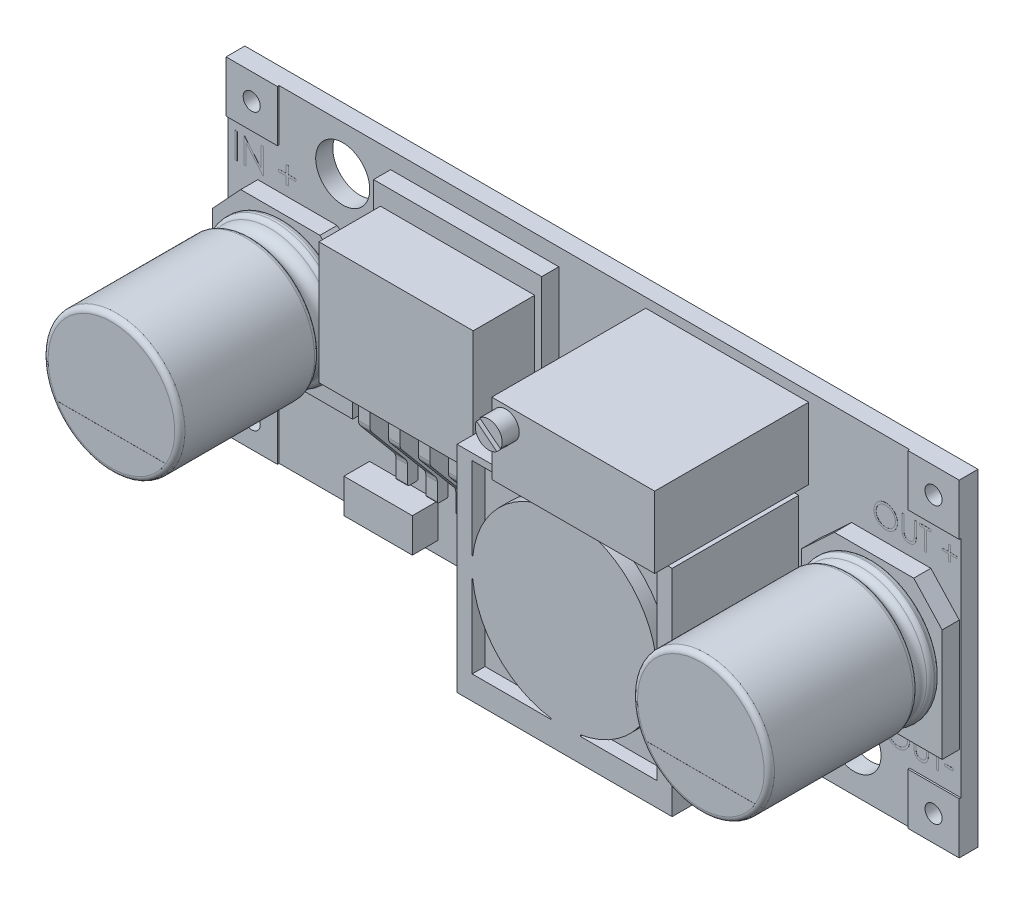
from build123d import *

# Parameters (mm, degrees)
SKETCH1_W            = 42.852737666
SKETCH1_H            = 19.127379028
SKETCH1_R            = 1.58
BOSS_EXTRUDE1_DEPTH  = 1
SKETCH2_W            = 3
SKETCH2_H            = 3
BOSS_EXTRUDE2_DEPTH  = 0.1
SKETCH3_R            = 0.5
CUT_EXTRUDE1_DEPTH   = 5
BOSS_EXTRUDE3_DEPTH  = 1
SKETCH6_W            = 9.83
SKETCH6_H            = 8.75
BOSS_EXTRUDE5_DEPTH  = 4.6
SKETCH7_W            = 9.83
SKETCH7_H            = 8.75
SKETCH7_W_2          = 9.014866003
SKETCH7_H_2          = 7.13033049
CUT_EXTRUDE2_DEPTH   = 3.6
SKETCH8_W            = 0.671327252
SKETCH8_H            = 3.75
BOSS_EXTRUDE6_DEPTH  = 8
SKETCH10_W           = 12.57
SKETCH10_H           = 12.57
BOSS_EXTRUDE7_DEPTH  = 7.4
CUT_EXTRUDE7_DEPTH   = 0.75
SKETCH13_W           = 9.52
SKETCH13_H           = 4.17
BOSS_EXTRUDE8_DEPTH  = 9
SKETCH14_R           = 0.785768403
BOSS_EXTRUDE9_DEPTH  = 1
CUT_EXTRUDE8_DEPTH   = 0.4
CUT_EXTRUDE10_DEPTH  = 9
SKETCH21_W           = 1
SKETCH21_H           = 0.471986251
BOSS_EXTRUDE11_DEPTH = 8.8665
BOSS_EXTRUDE15_DEPTH = 0.005
BOSS_EXTRUDE16_DEPTH = 0.005
SKETCH26_W           = 4
SKETCH26_H           = 2
BOSS_EXTRUDE18_DEPTH = 1.5
SKETCH28_W           = 0.134615385
SKETCH28_H           = 1.5
SKETCH28_W_2         = 0.576923077
SKETCH28_H_2         = 0.153846154
BOSS_EXTRUDE19_DEPTH = 0.005
SKETCH29_W           = 0.134615385
SKETCH29_H           = 1.5
BOSS_EXTRUDE20_DEPTH = 0.005
BOSS_EXTRUDE21_DEPTH = 0.005
SKETCH32_W           = 0.5
SKETCH32_H           = 0.133333333
BOSS_EXTRUDE23_DEPTH = 0.005


with BuildPart() as part:
    # Sketch1 → Boss-Extrude1 (new body)
    with BuildSketch(Plane.XY):
        Rectangle(SKETCH1_W, SKETCH1_H)
        with Locations((-14.706368833, 6.953689514)):
            Circle(SKETCH1_R, mode=Mode.SUBTRACT)
        with Locations((15.176368833, -6.773993326)):
            Circle(SKETCH1_R, mode=Mode.SUBTRACT)
    extrude(amount=BOSS_EXTRUDE1_DEPTH)

    # Sketch2 → Boss-Extrude2 (add)
    with BuildSketch(Plane.XY.offset(1)):
        with Locations((-19.926368833, 8.063689514)):
            Rectangle(SKETCH2_W, SKETCH2_H)
        with Locations((-19.926368833, -8.063689514)):
            Rectangle(SKETCH2_W, SKETCH2_H)
        with Locations((19.926368833, -8.063689514)):
            Rectangle(SKETCH2_W, SKETCH2_H)
        with Locations((19.926368833, 8.063689514)):
            Rectangle(SKETCH2_W, SKETCH2_H)
    extrude(amount=BOSS_EXTRUDE2_DEPTH)

    # Sketch3 → Cut-Extrude1 (cut)
    with BuildSketch(Plane.XY.offset(1.1)):
        with Locations((-19.926368833, 8.063689514)):
            Circle(SKETCH3_R)
        with Locations((-19.926368833, -8.063689514)):
            Circle(SKETCH3_R)
        with Locations((19.926368833, -8.063689514)):
            Circle(SKETCH3_R)
        with Locations((19.926368833, 8.063689514)):
            Circle(SKETCH3_R)
    extrude(amount=-CUT_EXTRUDE1_DEPTH, mode=Mode.SUBTRACT)

    # Sketch4 → Boss-Extrude3 (add)
    with BuildSketch(Plane.XY.offset(1)):
        Polygon((-15.037755442, 4.175), (-13.121368833, 2.397984661), (-13.121368833, -4.175), (-21.331368833, -4.175), (-21.331368833, 2.383236744), (-19.66991348, 4.175), align=None)
        Polygon((21.331368833, -4.175), (21.331368833, 2.383236744), (19.66991348, 4.175), (15.037755442, 4.175), (13.121368833, 2.397984661), (13.121368833, -4.175), align=None)
    extrude(amount=BOSS_EXTRUDE3_DEPTH)

    # Sketch6 → Boss-Extrude5 (add)
    with BuildSketch(Plane.XY.offset(1)):
        with Locations((-6.991368833, 4.188689514)):
            Rectangle(SKETCH6_W, SKETCH6_H)
    extrude(amount=BOSS_EXTRUDE5_DEPTH)

    # Sketch7 → Cut-Extrude2 (cut)
    with BuildSketch(Plane.XY.offset(5.6)):
        with Locations((-6.991368833, 4.188689514)):
            Rectangle(SKETCH7_W, SKETCH7_H)
        with Locations((-6.991368834, 3.853025888)):
            Rectangle(SKETCH7_W_2, SKETCH7_H_2, mode=Mode.SUBTRACT)
    extrude(amount=-CUT_EXTRUDE2_DEPTH, mode=Mode.SUBTRACT)

    # Sketch8 → Boss-Extrude6 (add)
    with BuildSketch(Plane(origin=(0, 0.287860643, 0), x_dir=(-1, 0, 0), z_dir=(0, -1, 0))):
        with Locations((8.85699558, -2.895840935)):
            Rectangle(SKETCH8_W, SKETCH8_H)
        with Locations((10.60699558, -2.895840935)):
            Rectangle(SKETCH8_W, SKETCH8_H)
        with Locations((7.10699558, -2.895840935)):
            Rectangle(SKETCH8_W, SKETCH8_H)
        with Locations((5.35699558, -2.895840935)):
            Rectangle(SKETCH8_W, SKETCH8_H)
        with Locations((3.60699558, -2.895840935)):
            Rectangle(SKETCH8_W, SKETCH8_H)
    extrude(amount=BOSS_EXTRUDE6_DEPTH)

    # Sketch10 → Boss-Extrude7 (add)
    with BuildSketch(Plane.XY.offset(1)):
        with Locations((5.661368833, -2.278689514)):
            Rectangle(SKETCH10_W, SKETCH10_H)
    extrude(amount=BOSS_EXTRUDE7_DEPTH)

    # Sketch11 → Cut-Extrude7 (cut)
    with BuildSketch(Plane.XY.offset(8.4)):
        with BuildLine():
            Line((0.261368833, -1.168201078), (0.29215187, -1.202921155))
            ThreePointArc((0.29215187, -1.202921155), (1.796004083, 1.992113497), (4.952819072, 3.574623221))
            Line((4.952819072, 3.574623221), (4.952819072, 3.621310486))
            Line((4.952819072, 3.621310486), (0.261368833, 3.621310486))
            Line((0.261368833, 3.621310486), (0.261368833, -1.168201078))
        make_face()
        with BuildLine():
            Line((0.261368833, -2.339421454), (0.29215187, -2.354457873))
            ThreePointArc((0.29215187, -2.354457873), (1.77039453, -5.523061153), (4.879917239, -7.121847139))
            Line((4.879917239, -7.121847139), (4.879917239, -7.178689514))
            Line((4.879917239, -7.178689514), (0.261368833, -7.178689514))
            Line((0.261368833, -7.178689514), (0.261368833, -2.339421454))
        make_face()
        with BuildLine():
            Line((11.061368833, -7.178689514), (11.061368833, -2.769135856))
            Line((11.061368833, -2.769135856), (10.969759931, -2.769135856))
            ThreePointArc((10.969759931, -2.769135856), (9.454565933, -5.622080694), (6.581950193, -7.099641493))
            Line((6.581950193, -7.099641493), (6.581950193, -7.178689514))
            Line((6.581950193, -7.178689514), (11.061368833, -7.178689514))
        make_face()
        with BuildLine():
            Line((6.280607425, 3.621310486), (6.280607425, 3.585687763))
            ThreePointArc((6.280607425, 3.585687763), (9.344711933, 2.170105696), (10.969759931, -0.788243173))
            Line((10.969759931, -0.788243173), (11.061368833, -0.788243173))
            Line((11.061368833, -0.788243173), (11.061368833, 3.621310486))
            Line((11.061368833, 3.621310486), (6.280607425, 3.621310486))
        make_face()
    extrude(amount=-CUT_EXTRUDE7_DEPTH, mode=Mode.SUBTRACT)

    # Sketch13 → Boss-Extrude8 (add)
    with BuildSketch(Plane.XY.offset(1)):
        with Locations((7.766965878, 6.922076652)):
            Rectangle(SKETCH13_W, SKETCH13_H)
    extrude(amount=BOSS_EXTRUDE8_DEPTH)

    # Sketch14 → Boss-Extrude9 (add)
    with BuildSketch(Plane.XY.offset(10)):
        with Locations((3.826540336, 8.02238566)):
            Circle(SKETCH14_R)
    extrude(amount=BOSS_EXTRUDE9_DEPTH)

    # Sketch16 → Cut-Extrude8 (cut)
    with BuildSketch(Plane.XY.offset(11)):
        Polygon((3.174779735, 8.708212326), (4.655828555, 7.530657116), (4.452314558, 7.274691057), (2.971265737, 8.452246267), align=None)
    extrude(amount=-CUT_EXTRUDE8_DEPTH, mode=Mode.SUBTRACT)

    # Sketch17 → Revolve1 (revolve)
    with BuildSketch(Plane(origin=(0, 0, 0), x_dir=(1, 0, 0), z_dir=(0, 1, 0))):
        with BuildLine():
            Line((-17.226368833, -2), (-17.226368833, -12))
            Line((-17.226368833, -12), (-20.926368833, -12))
            ThreePointArc((-20.926368833, -12), (-21.138500868, -11.912132034), (-21.226368833, -11.7))
            Line((-21.226368833, -11.7), (-21.226368833, -4.126856579))
            ThreePointArc((-21.226368833, -4.126856579), (-21.171634617, -3.954100406), (-21.027404197, -3.844382058))
            ThreePointArc((-21.027404197, -3.844382058), (-20.635591614, -3.288117016), (-21.027404197, -2.731851974))
            ThreePointArc((-21.027404197, -2.731851974), (-21.171634617, -2.622133626), (-21.226368833, -2.449377452))
            Line((-21.226368833, -2.449377452), (-21.226368833, -2.3))
            ThreePointArc((-21.226368833, -2.3), (-21.138500868, -2.087867966), (-20.926368833, -2))
            Line((-20.926368833, -2), (-17.226368833, -2))
        make_face()
    revolve(axis=Axis((-17.226368833, 0, 2), (0, 0, 1)))

    # Sketch18 → Revolve2 (revolve)
    with BuildSketch(Plane(origin=(0, 0, 0), x_dir=(1, 0, 0), z_dir=(0, 1, 0)), mode=Mode.PRIVATE) as revolve2_sk:
        with BuildLine():
            Line((17.226368833, -2), (17.226368833, -12))
            Line((17.226368833, -12), (20.926368833, -12))
            ThreePointArc((20.926368833, -12), (21.138500868, -11.912132034), (21.226368833, -11.7))
            Line((21.226368833, -11.7), (21.226368833, -3.602613577))
            ThreePointArc((21.226368833, -3.602613577), (21.180569431, -3.443296107), (21.057155126, -3.332622937))
            ThreePointArc((21.057155126, -3.332622937), (20.838223322, -2.983304086), (21.057155126, -2.633985236))
            ThreePointArc((21.057155126, -2.633985236), (21.180569431, -2.523312065), (21.226368833, -2.363994596))
            Line((21.226368833, -2.363994596), (21.226368833, -2.3))
            ThreePointArc((21.226368833, -2.3), (21.138500868, -2.087867966), (20.926368833, -2))
            Line((20.926368833, -2), (17.226368833, -2))
        make_face()
    revolve(revolve2_sk.sketch.rotate(Axis((17.226368833, 0, 2), (0, 0, 1)), 180), axis=Axis((17.226368833, 0, 2), (0, 0, 1)))

    # Sketch20 → Cut-Extrude10 (cut)
    with BuildSketch(Plane.ZY.offset(10.942659206)):
        with BuildLine():
            Line((3.844382058, 0.289594832), (3.844382058, -2.233611219))
            ThreePointArc((3.844382058, -2.233611219), (3.814255779, -2.404545961), (3.727507314, -2.554882192))
            Line((3.727507314, -2.554882192), (1.771316926, -4.887697811))
            ThreePointArc((1.771316926, -4.887697811), (1.684568461, -5.038034042), (1.654442182, -5.208968784))
            Line((1.654442182, -5.208968784), (1.654442182, -6.229630862))
            ThreePointArc((1.654442182, -6.229630862), (1.62515286, -6.30034154), (1.554442182, -6.329630862))
            Line((1.554442182, -6.329630862), (1.11972155, -6.329630862))
            ThreePointArc((1.11972155, -6.329630862), (1.049409976, -6.300738404), (1.019727886, -6.230756512))
            Line((1.019727886, -6.230756512), (1.020840935, -4.455804963))
            Line((1.020840935, -4.455804963), (1.118926503, -4.336466333))
            Line((1.118926503, -4.336466333), (2.914592321, -2.19508107))
            ThreePointArc((2.914592321, -2.19508107), (3.001340787, -2.044744838), (3.031467065, -1.873810097))
            Line((3.031467065, -1.873810097), (3.031467065, 0.289594832))
            Line((3.031467065, 0.289594832), (1, 0.289594832))
            Line((1, 0.289594832), (1.020840935, -10.491278281))
            Line((1.020840935, -10.491278281), (8.137669671, -10.491278281))
            Line((8.137669671, -10.491278281), (8.137669671, 0.289594832))
            Line((8.137669671, 0.289594832), (3.844382058, 0.289594832))
        make_face()
    extrude(amount=-CUT_EXTRUDE10_DEPTH, mode=Mode.SUBTRACT)

    # Sketch21 → Boss-Extrude11 (add)
    with BuildSketch(Plane(origin=(-10.942659206, 0, 0), x_dir=(0, 0, -1), z_dir=(1, 0, 0))):
        with Locations((-1.5, 0.051867518)):
            Rectangle(SKETCH21_W, SKETCH21_H)
    extrude(amount=BOSS_EXTRUDE11_DEPTH)

    # Sketch24 → Boss-Extrude15 (add)
    # profile 1 of 6: a face of its own
    with BuildSketch(Plane(origin=(0, 0, 0), x_dir=(-1, 0, 0), z_dir=(0, 0, -1))):
        with BuildLine():
            Line((-8.853067867, -3.201602436), (-8.300583893, -3.201602436))
            add(Edge.make_bspline(
                [(-8.300583893, -3.201602436), (-8.237941582, -3.202119806), (-8.116803517, -3.2031203), (-7.941132069, -3.211369625), (-7.778093699, -3.225929961), (-7.627390082, -3.246082478), (-7.489008967, -3.271793508), (-7.362897501, -3.302926325), (-7.248929994, -3.33975745), (-7.146788875, -3.384011044), (-7.052741114, -3.433669947), (-6.964605447, -3.490333151), (-6.880863878, -3.553292994), (-6.800951691, -3.622151102), (-6.726488735, -3.698419974), (-6.656427117, -3.781295695), (-6.590498662, -3.870598609), (-6.528925787, -3.965401624), (-6.473540425, -4.065638061), (-6.425157038, -4.17040503), (-6.383616919, -4.278708953), (-6.350761029, -4.391144359), (-6.324787465, -4.507073724), (-6.30590624, -4.626948975), (-6.294380489, -4.750619862), (-6.293179073, -4.834256468), (-6.292571072, -4.876582403)],
                knots=[0, 0, 0, 0, 1.508928034, 2.917973822, 4.235011166, 5.450779055, 6.579221784, 7.623755204, 8.577985451, 9.460610614, 10.301756591, 11.137250569, 11.981705789, 12.823774396, 13.675702816, 14.546470419, 15.435981066, 16.347923198, 17.267651715, 18.192054867, 19.125737078, 20.059147693, 21.011116727, 21.985721956, 22.980635317, 24, 24, 24, 24], degree=3))
            add(Edge.make_bspline(
                [(-6.292571072, -4.876582403), (-6.293425352, -4.920311883), (-6.295123351, -5.007230329), (-6.307307235, -5.136032527), (-6.327011019, -5.262226316), (-6.354170607, -5.385767842), (-6.3899407, -5.506706382), (-6.434603556, -5.624404735), (-6.485458331, -5.740040139), (-6.545219263, -5.851234457), (-6.609667677, -5.957998129), (-6.679444673, -6.057826354), (-6.752629295, -6.150611392), (-6.831061771, -6.235080332), (-6.913235525, -6.312436895), (-6.99918107, -6.382679297), (-7.089825573, -6.444833173), (-7.185067073, -6.50000274), (-7.287441231, -6.548363362), (-7.398515284, -6.589331765), (-7.518630599, -6.624543208), (-7.64836209, -6.652031833), (-7.787090893, -6.674472281), (-7.935212637, -6.690545123), (-8.092710466, -6.699344016), (-8.200780305, -6.700834932), (-8.25641322, -6.701602436)],
                knots=[0, 0, 0, 0, 1.035326767, 2.057856534, 3.060426681, 4.057975219, 5.050723532, 6.043595218, 7.036960241, 8.039530388, 9.030318104, 9.988216712, 10.921569661, 11.826132526, 12.714780289, 13.59198308, 14.451536877, 15.31430869, 16.195534129, 17.128821459, 18.114698389, 19.15667332, 20.266554844, 21.441073174, 22.682698532, 24, 24, 24, 24], degree=3))
            Line((-8.25641322, -6.701602436), (-9.343853124, -6.701602436))
            Line((-9.343853124, -6.701602436), (-8.853067867, -3.201602436))
        make_face()
        with BuildLine():
            Line((-8.301285015, -3.784935769), (-8.628007771, -6.118269102))
            Line((-8.628007771, -6.118269102), (-8.401545431, -6.118269102))
            add(Edge.make_bspline(
                [(-8.401545431, -6.118269102), (-8.359472268, -6.118053614), (-8.278575358, -6.11763928), (-8.161717216, -6.113000816), (-8.053842471, -6.107478867), (-7.955006915, -6.097225324), (-7.864849413, -6.085815911), (-7.783982406, -6.070951496), (-7.711475788, -6.05497426), (-7.667362252, -6.039888218), (-7.646437258, -6.032732243)],
                knots=[0, 0, 0, 0, 1.323091274, 2.54399687, 3.677836413, 4.719289959, 5.668358043, 6.534823038, 7.305002022, 8, 8, 8, 8], degree=3))
            add(Edge.make_bspline(
                [(-7.646437258, -6.032732243), (-7.619551047, -6.022282483), (-7.566139112, -6.001523071), (-7.490813536, -5.961141901), (-7.417728748, -5.91834265), (-7.350080591, -5.868000695), (-7.285471108, -5.813353309), (-7.226484995, -5.752065729), (-7.170258599, -5.686392133), (-7.118784674, -5.615067595), (-7.071727449, -5.539236121), (-7.03165369, -5.4583046), (-6.997050982, -5.373348417), (-6.969343034, -5.283665493), (-6.947389037, -5.18996392), (-6.932390442, -5.091965491), (-6.921919041, -4.989689841), (-6.921161696, -4.919845967), (-6.920776201, -4.884294743)],
                knots=[0, 0, 0, 0, 0.952655881, 1.892538673, 2.821337892, 3.750040712, 4.676008024, 5.615700279, 6.558436491, 7.532008524, 8.520486916, 9.505184105, 10.513747313, 11.549809891, 12.604882282, 13.692134403, 14.825273528, 16, 16, 16, 16], degree=3))
            add(Edge.make_bspline(
                [(-6.920776201, -4.884294743), (-6.921179041, -4.855071947), (-6.921966371, -4.79795763), (-6.928152939, -4.714096916), (-6.939619582, -4.633858217), (-6.954627208, -4.557196683), (-6.974573544, -4.484179286), (-6.998342056, -4.414821288), (-7.026031761, -4.348620501), (-7.070347076, -4.266962682), (-7.13351499, -4.171693487), (-7.225790052, -4.070996953), (-7.33302123, -3.98497526), (-7.432971683, -3.92486041), (-7.520199452, -3.883726716), (-7.59183677, -3.8573879), (-7.668642489, -3.83477797), (-7.750749545, -3.817072039), (-7.837674138, -3.801859673), (-7.930010535, -3.792738629), (-8.027513589, -3.785982745), (-8.094440862, -3.785290994), (-8.128809053, -3.784935769)],
                knots=[0, 0, 0, 0, 0.941373656, 1.839862062, 2.706559874, 3.551131217, 4.354742518, 5.142827075, 5.911946928, 6.663057697, 8.133107042, 9.582556681, 11.0440985, 12.547036792, 13.328439944, 14.147940985, 15.003216405, 15.905576335, 16.852443473, 17.844335315, 18.893032825, 20, 20, 20, 20], degree=3))
            Line((-8.128809053, -3.784935769), (-8.301285015, -3.784935769))
        make_face(mode=Mode.SUBTRACT)
    # profile 2 of 6: a face of its own
    with BuildSketch(Plane(origin=(0, 0, 0), x_dir=(-1, 0, 0), z_dir=(0, 0, -1))):
        with BuildLine():
            Line((-2.516329085, -3.641906923), (-3.000804245, -4.075901314))
            add(Edge.make_bspline(
                [(-3.000804245, -4.075901314), (-3.027689891, -4.046443608), (-3.081355477, -3.987644013), (-3.174342582, -3.912136081), (-3.27509105, -3.846413961), (-3.384058099, -3.79185051), (-3.499594178, -3.74827086), (-3.620707569, -3.71756322), (-3.746679282, -3.698815861), (-3.832269402, -3.696413914), (-3.875804245, -3.695192179)],
                knots=[0, 0, 0, 0, 0.971056601, 1.938295404, 2.910103745, 3.898650509, 4.902833105, 5.914277838, 6.939111328, 8, 8, 8, 8], degree=3))
            add(Edge.make_bspline(
                [(-3.875804245, -3.695192179), (-3.906675858, -3.695675914), (-3.968088952, -3.696638212), (-4.059697798, -3.706102921), (-4.150266957, -3.72165531), (-4.239943908, -3.742704476), (-4.328944794, -3.76918723), (-4.416297099, -3.803150435), (-4.502814844, -3.842651021), (-4.588093545, -3.887070685), (-4.670046059, -3.937343286), (-4.748053762, -3.991342039), (-4.821369329, -4.048887662), (-4.889619278, -4.110909594), (-4.953232815, -4.176978556), (-5.013363848, -4.246067771), (-5.067011582, -4.32032101), (-5.116983668, -4.396986923), (-5.160899411, -4.47683975), (-5.199278835, -4.558168777), (-5.233164672, -4.640393752), (-5.258161359, -4.724798488), (-5.280114045, -4.809950053), (-5.294189305, -4.89679304), (-5.304020845, -4.984796415), (-5.304933001, -5.043888985), (-5.305391585, -5.073597628)],
                knots=[0, 0, 0, 0, 1.01063672, 2.010466049, 3.011934156, 4.018040672, 5.025194429, 6.049901815, 7.084166442, 8.138480354, 9.196343408, 10.230183256, 11.243713301, 12.245999792, 13.247233952, 14.245803109, 15.242258641, 16.244194478, 17.240973215, 18.223430354, 19.188354289, 20.149355445, 21.103383867, 22.065846529, 23.027609163, 24, 24, 24, 24], degree=3))
            add(Edge.make_bspline(
                [(-5.305391585, -5.073597628), (-5.304618516, -5.113391242), (-5.303097502, -5.191685253), (-5.286027884, -5.306388491), (-5.2606216, -5.416222202), (-5.223849505, -5.520820556), (-5.176425789, -5.619953738), (-5.119765611, -5.714793755), (-5.050821374, -5.803061224), (-4.973598797, -5.886385022), (-4.887657649, -5.961519344), (-4.795556562, -6.028219859), (-4.696709043, -6.083473122), (-4.592429621, -6.1296467), (-4.481782992, -6.164421161), (-4.365622271, -6.189522151), (-4.243638542, -6.205554834), (-4.160277037, -6.207181632), (-4.117691265, -6.208012692)],
                knots=[0, 0, 0, 0, 1.037508871, 2.041300697, 3.018951676, 3.975513831, 4.927438979, 5.88223082, 6.851861871, 7.844178858, 8.842305637, 9.825493826, 10.805727671, 11.791408773, 12.796144752, 13.825955475, 14.88937509, 16, 16, 16, 16], degree=3))
            add(Edge.make_bspline(
                [(-4.117691265, -6.208012692), (-4.071855206, -6.207230549), (-3.981640883, -6.205691138), (-3.848815917, -6.192765403), (-3.720676217, -6.1717802), (-3.597313824, -6.14259959), (-3.478605564, -6.104256454), (-3.364521871, -6.058307341), (-3.254927312, -6.003502583), (-3.186042547, -5.96037832), (-3.151545431, -5.938781923)],
                knots=[0, 0, 0, 0, 1.080949117, 2.127519159, 3.144326023, 4.141762213, 5.114520833, 6.083915527, 7.040435296, 8, 8, 8, 8], degree=3))
            Line((-3.151545431, -5.938781923), (-2.758216104, -6.372075192))
            add(Edge.make_bspline(
                [(-2.758216104, -6.372075192), (-2.808420285, -6.405619613), (-2.908553491, -6.472524609), (-3.067420241, -6.557854709), (-3.232244225, -6.629482919), (-3.402422898, -6.688487904), (-3.578358143, -6.735128768), (-3.760308538, -6.767720941), (-3.948257224, -6.788017038), (-4.075571862, -6.790225976), (-4.140127162, -6.791346025)],
                knots=[0, 0, 0, 0, 0.987115275, 1.968820479, 2.944554184, 3.923725951, 4.912076401, 5.918257257, 6.944445583, 8, 8, 8, 8], degree=3))
            add(Edge.make_bspline(
                [(-4.140127162, -6.791346025), (-4.185251648, -6.79064853), (-4.273972366, -6.789277163), (-4.404318153, -6.779211808), (-4.529637736, -6.763462206), (-4.649689886, -6.740131924), (-4.764708942, -6.710859161), (-4.874722042, -6.675176034), (-4.979294215, -6.632155799), (-5.079055533, -6.583302387), (-5.173473742, -6.527349338), (-5.263416272, -6.465790051), (-5.348210229, -6.397518319), (-5.428568985, -6.323744653), (-5.503749999, -6.243559869), (-5.573944978, -6.156875672), (-5.639773669, -6.064401239), (-5.70059437, -5.966617988), (-5.755204621, -5.864510256), (-5.802525631, -5.759422355), (-5.843974618, -5.652784518), (-5.875684831, -5.543225299), (-5.90207982, -5.432193883), (-5.919990953, -5.318507609), (-5.931786958, -5.20308897), (-5.932991892, -5.125276243), (-5.933596713, -5.08621782)],
                knots=[0, 0, 0, 0, 1.169367826, 2.299132101, 3.38621766, 4.441052208, 5.466435492, 6.460518735, 7.435693363, 8.394593391, 9.33676259, 10.277587488, 11.216890426, 12.155626877, 13.10261201, 14.062754619, 15.044266364, 16.042621295, 17.045211417, 18.042739217, 19.028130471, 20.007415779, 20.996189116, 21.983978755, 22.988049715, 24, 24, 24, 24], degree=3))
            add(Edge.make_bspline(
                [(-5.933596713, -5.08621782), (-5.932861533, -5.04411236), (-5.931395617, -4.960155988), (-5.917258447, -4.834871806), (-5.895871713, -4.710906453), (-5.865255859, -4.588265385), (-5.827115892, -4.466902485), (-5.778657886, -4.347333602), (-5.722841666, -4.228544831), (-5.657519442, -4.112320265), (-5.58623039, -3.999158565), (-5.507106607, -3.892166544), (-5.422083349, -3.791259164), (-5.331916975, -3.695486851), (-5.234644888, -3.606974946), (-5.131164403, -3.524800413), (-5.021858395, -3.448393062), (-4.906896824, -3.37836971), (-4.787888864, -3.315426453), (-4.665133983, -3.261466361), (-4.540055011, -3.214775861), (-4.412146752, -3.177011734), (-4.281335611, -3.148296897), (-4.148154069, -3.127222676), (-4.012079129, -3.114262257), (-3.920470313, -3.112663054), (-3.874402002, -3.111858846)],
                knots=[0, 0, 0, 0, 0.95794203, 1.910092795, 2.865876462, 3.819215003, 4.78477586, 5.758651491, 6.753180615, 7.769892659, 8.790977917, 9.795230985, 10.79565955, 11.792688852, 12.786634645, 13.785945562, 14.798181656, 15.819862441, 16.847685968, 17.859754353, 18.869513914, 19.884373831, 20.892254455, 21.915374149, 22.951681752, 24, 24, 24, 24], degree=3))
            add(Edge.make_bspline(
                [(-3.874402002, -3.111858846), (-3.810055091, -3.11349608), (-3.682990372, -3.116729098), (-3.495855983, -3.141778928), (-3.315253236, -3.183068658), (-3.141427217, -3.241768031), (-2.973739072, -3.316085821), (-2.813300361, -3.407960246), (-2.659434296, -3.516158186), (-2.564439018, -3.599631989), (-2.516329085, -3.641906923)],
                knots=[0, 0, 0, 0, 1.033545388, 2.040923972, 3.027343848, 4.005734438, 4.983995331, 5.969464303, 6.971644303, 8, 8, 8, 8], degree=3))
        make_face()
    # profile 3 of 6: a face of its own
    with BuildSketch(Plane(origin=(0, 0, 0), x_dir=(-1, 0, 0), z_dir=(0, 0, -1))):
        Polygon((-0.410159213, -3.111858846), (0.222953767, -3.111858846), (0.079924921, -4.143910128), (0.480265466, -4.143910128), (0.404544312, -4.682371666), (0.004904889, -4.682371666), (-0.274842707, -6.701602436), (-0.907955688, -6.701602436), (-0.628208092, -4.682371666), (-0.938103925, -4.682371666), (-0.865187258, -4.143910128), (-0.55318806, -4.143910128), align=None)
    # profile 4 of 6: a face of its own
    with BuildSketch(Plane(origin=(0, 0, 0), x_dir=(-1, 0, 0), z_dir=(0, 0, -1))):
        with BuildLine():
            add(Edge.make_bspline(
                [(2.047973799, -4.099038333), (2.076274595, -4.099299194), (2.132285658, -4.099815473), (2.215320607, -4.108289871), (2.296630321, -4.119781478), (2.375824228, -4.136585397), (2.452832337, -4.158540762), (2.527980657, -4.185285631), (2.60145491, -4.216550706), (2.672238505, -4.253235701), (2.740269169, -4.293778731), (2.804923453, -4.338492614), (2.865124606, -4.38802221), (2.922560732, -4.440435569), (2.974812186, -4.498109595), (3.023299378, -4.559402443), (3.068608414, -4.624279456), (3.109671999, -4.693140326), (3.145833773, -4.765563415), (3.178489854, -4.839690233), (3.205172311, -4.916663144), (3.226421779, -4.995747754), (3.2447274, -5.076764828), (3.255780853, -5.160081933), (3.264388007, -5.245427615), (3.264874499, -5.303074566), (3.265121235, -5.33231157)],
                knots=[0, 0, 0, 0, 1.048380346, 2.074885017, 3.090367486, 4.090964834, 5.072523792, 6.056029873, 7.045505985, 8.029469653, 9.008388104, 9.979110116, 10.939576094, 11.895736256, 12.858269977, 13.820062943, 14.790784955, 15.789017664, 16.788414625, 17.789274365, 18.789121639, 19.804049856, 20.823403653, 21.864603227, 22.916983403, 24, 24, 24, 24], degree=3))
            add(Edge.make_bspline(
                [(3.265121235, -5.33231157), (3.263688521, -5.380517747), (3.260866665, -5.475463977), (3.241081251, -5.615137253), (3.207266567, -5.74903449), (3.159927545, -5.877543045), (3.099373535, -6.000696485), (3.02535317, -6.118605175), (2.937002499, -6.230040516), (2.837387566, -6.33526087), (2.728079792, -6.431651196), (2.610873296, -6.515964174), (2.4872728, -6.58723861), (2.357586463, -6.646044139), (2.220868971, -6.690744346), (2.07813408, -6.722759932), (1.929142107, -6.743245327), (1.827655912, -6.74538424), (1.775938543, -6.74647423)],
                knots=[0, 0, 0, 0, 1.011104245, 1.991457176, 2.952197104, 3.902991464, 4.858928698, 5.826026836, 6.817568841, 7.837123857, 8.861887107, 9.870051414, 10.860623363, 11.850212162, 12.851715058, 13.872153699, 14.915649431, 16, 16, 16, 16], degree=3))
            add(Edge.make_bspline(
                [(1.775938543, -6.74647423), (1.731249527, -6.745651728), (1.643928175, -6.744044575), (1.516603984, -6.728008378), (1.396019942, -6.703330608), (1.282509145, -6.667113928), (1.175619563, -6.621862978), (1.075787771, -6.565800352), (0.982759572, -6.499972186), (0.898424611, -6.423206126), (0.821653652, -6.339253127), (0.755109673, -6.247910845), (0.698196439, -6.150383479), (0.652979584, -6.046129966), (0.616951777, -5.936058116), (0.591083712, -5.819874659), (0.575325308, -5.697330635), (0.573662775, -5.613509398), (0.572813543, -5.57069298)],
                knots=[0, 0, 0, 0, 1.130534475, 2.209039425, 3.242686211, 4.241648197, 5.219495055, 6.175504508, 7.134035888, 8.097337106, 9.056251676, 10.008649417, 10.952170628, 11.908308165, 12.879116703, 13.879338768, 14.916752852, 16, 16, 16, 16], degree=3))
            add(Edge.make_bspline(
                [(0.572813543, -5.57069298), (0.574198313, -5.518982083), (0.576922459, -5.417255379), (0.597291897, -5.267943873), (0.632580393, -5.125671277), (0.6813243, -4.990183027), (0.742880461, -4.860841068), (0.820364868, -4.739285803), (0.910265871, -4.623536234), (1.013729882, -4.516782318), (1.125759831, -4.419397073), (1.243349941, -4.333250807), (1.366627978, -4.261598623), (1.493529484, -4.201082976), (1.626190512, -4.155869136), (1.762694186, -4.122668379), (1.903868267, -4.102397962), (1.999529842, -4.100167739), (2.047973799, -4.099038333)],
                knots=[0, 0, 0, 0, 1.070407058, 2.105725986, 3.11260329, 4.099768105, 5.082273654, 6.071629737, 7.078227986, 8.111679688, 9.144009435, 10.148605521, 11.124500349, 12.092034995, 13.054511379, 14.020338642, 14.997480131, 16, 16, 16, 16], degree=3))
        make_face()
        with BuildLine():
            add(Edge.make_bspline(
                [(2.001699761, -4.682371666), (1.970338874, -4.683134377), (1.909219823, -4.68462082), (1.820371221, -4.697480802), (1.737116329, -4.718430504), (1.65914239, -4.747759684), (1.587488188, -4.786890542), (1.520576481, -4.833288128), (1.460350398, -4.889250385), (1.406081405, -4.952161975), (1.358245618, -5.020002489), (1.316206249, -5.089796935), (1.280624192, -5.161264017), (1.252338528, -5.234222955), (1.228428254, -5.308196637), (1.212541328, -5.383864445), (1.203329833, -5.461089737), (1.201794454, -5.512942704), (1.201018671, -5.5391425)],
                knots=[0, 0, 0, 0, 1.147646984, 2.236642535, 3.278363253, 4.285788599, 5.277283386, 6.259990092, 7.25913394, 8.278119336, 9.296601724, 10.294389209, 11.258634566, 12.215104854, 13.156804447, 14.101569642, 15.040778374, 16, 16, 16, 16], degree=3))
            add(Edge.make_bspline(
                [(1.201018671, -5.5391425), (1.201601551, -5.562064552), (1.202740963, -5.606872574), (1.210344539, -5.672404719), (1.22384553, -5.734276966), (1.241836873, -5.792939391), (1.266036711, -5.848077326), (1.295236911, -5.899903115), (1.330284842, -5.947905553), (1.36903979, -5.992964645), (1.413485986, -6.03267378), (1.461057482, -6.067795173), (1.512112733, -6.097851128), (1.567183892, -6.121362981), (1.625520167, -6.140560096), (1.687347255, -6.15367305), (1.752600705, -6.161479998), (1.797183596, -6.162576862), (1.820109216, -6.163140897)],
                knots=[0, 0, 0, 0, 1.110133544, 2.170088686, 3.189065258, 4.17351184, 5.136579884, 6.099647928, 7.048308506, 8.010844321, 8.972448026, 9.927769731, 10.871216919, 11.834284962, 12.822174017, 13.841150589, 14.889866456, 16, 16, 16, 16], degree=3))
            add(Edge.make_bspline(
                [(1.820109216, -6.163140897), (1.852396439, -6.162309401), (1.915329168, -6.160688687), (2.006752353, -6.148807507), (2.092157747, -6.128631912), (2.171520471, -6.099746544), (2.244757291, -6.062223255), (2.312768778, -6.017389235), (2.37401388, -5.963374241), (2.429161959, -5.902432595), (2.477619401, -5.836248997), (2.519922528, -5.766868854), (2.556594156, -5.695618423), (2.586181307, -5.62167797), (2.608565063, -5.545547851), (2.624745195, -5.467237991), (2.634787654, -5.386557462), (2.636202075, -5.331872791), (2.636916107, -5.304266698)],
                knots=[0, 0, 0, 0, 1.164111062, 2.269030304, 3.317651816, 4.322802953, 5.30652745, 6.278887004, 7.252451034, 8.242831511, 9.237327035, 10.205734188, 11.170614506, 12.123681709, 13.072978069, 14.028315502, 15.004647829, 16, 16, 16, 16], degree=3))
            add(Edge.make_bspline(
                [(2.636916107, -5.304266698), (2.636389507, -5.281805954), (2.635354416, -5.237656817), (2.626861779, -5.173063933), (2.612670679, -5.111911081), (2.594004984, -5.053572817), (2.568363816, -4.999146348), (2.538407469, -4.947143567), (2.501272598, -4.899639821), (2.460229432, -4.854843601), (2.414885669, -4.814121082), (2.365286189, -4.779019773), (2.312962754, -4.74858569), (2.256729337, -4.72478642), (2.197581756, -4.705876334), (2.135261979, -4.69159541), (2.069423748, -4.684129775), (2.024619754, -4.682966667), (2.001699761, -4.682371666)],
                knots=[0, 0, 0, 0, 1.079193067, 2.121276228, 3.123935011, 4.093589047, 5.058482656, 6.010079462, 6.971567708, 7.949254825, 8.927715837, 9.893916005, 10.864935156, 11.830939453, 12.821955205, 13.846519011, 14.898362312, 16, 16, 16, 16], degree=3))
        make_face(mode=Mode.SUBTRACT)
    # profile 5 of 6: a face of its own
    with BuildSketch(Plane(origin=(0, 0, 0), x_dir=(-1, 0, 0), z_dir=(0, 0, -1))):
        with BuildLine():
            Line((5.550778287, -3.201602436), (6.103262261, -3.201602436))
            add(Edge.make_bspline(
                [(6.103262261, -3.201602436), (6.165904571, -3.202119806), (6.287042636, -3.2031203), (6.462714085, -3.211369625), (6.625752455, -3.225929961), (6.776456072, -3.246082478), (6.914837187, -3.271793508), (7.040948653, -3.302926325), (7.15491616, -3.33975745), (7.257057279, -3.384011044), (7.35110504, -3.433669947), (7.439240707, -3.490333151), (7.522982276, -3.553292994), (7.602894463, -3.622151102), (7.677357419, -3.698419974), (7.747419037, -3.781295695), (7.813347492, -3.870598609), (7.874920367, -3.965401624), (7.930305729, -4.065638061), (7.978689115, -4.17040503), (8.020229235, -4.278708953), (8.053085125, -4.391144359), (8.079058689, -4.507073724), (8.097939914, -4.626948975), (8.109465665, -4.750619862), (8.110667081, -4.834256468), (8.111275081, -4.876582403)],
                knots=[0, 0, 0, 0, 1.508928034, 2.917973822, 4.235011166, 5.450779055, 6.579221784, 7.623755204, 8.577985451, 9.460610614, 10.301756591, 11.137250569, 11.981705789, 12.823774396, 13.675702816, 14.546470419, 15.435981066, 16.347923198, 17.267651715, 18.192054867, 19.125737078, 20.059147693, 21.011116727, 21.985721956, 22.980635317, 24, 24, 24, 24], degree=3))
            add(Edge.make_bspline(
                [(8.111275081, -4.876582403), (8.110420802, -4.920311883), (8.108722803, -5.007230329), (8.096538919, -5.136032527), (8.076835135, -5.262226316), (8.049675547, -5.385767842), (8.013905454, -5.506706382), (7.969242598, -5.624404735), (7.918387823, -5.740040139), (7.858626891, -5.851234457), (7.794178477, -5.957998129), (7.724401481, -6.057826354), (7.651216859, -6.150611392), (7.572784383, -6.235080332), (7.490610629, -6.312436895), (7.404665084, -6.382679297), (7.314020581, -6.444833173), (7.21877908, -6.50000274), (7.116404923, -6.548363362), (7.005330869, -6.589331765), (6.885215554, -6.624543208), (6.755484064, -6.652031833), (6.616755261, -6.674472281), (6.468633517, -6.690545123), (6.311135688, -6.699344016), (6.203065849, -6.700834932), (6.147432934, -6.701602436)],
                knots=[0, 0, 0, 0, 1.035326767, 2.057856534, 3.060426681, 4.057975219, 5.050723532, 6.043595218, 7.036960241, 8.039530388, 9.030318104, 9.988216712, 10.921569661, 11.826132526, 12.714780289, 13.59198308, 14.451536877, 15.31430869, 16.195534129, 17.128821459, 18.114698389, 19.15667332, 20.266554844, 21.441073174, 22.682698532, 24, 24, 24, 24], degree=3))
            Line((6.147432934, -6.701602436), (5.05999303, -6.701602436))
            Line((5.05999303, -6.701602436), (5.550778287, -3.201602436))
        make_face()
        with BuildLine():
            Line((6.102561139, -3.784935769), (5.775838383, -6.118269102))
            Line((5.775838383, -6.118269102), (6.002300723, -6.118269102))
            add(Edge.make_bspline(
                [(6.002300723, -6.118269102), (6.044373886, -6.118053614), (6.125270795, -6.11763928), (6.242128938, -6.113000816), (6.350003683, -6.107478867), (6.448839239, -6.097225324), (6.538996741, -6.085815911), (6.619863748, -6.070951496), (6.692370365, -6.05497426), (6.736483902, -6.039888218), (6.757408896, -6.032732243)],
                knots=[0, 0, 0, 0, 1.323091274, 2.54399687, 3.677836413, 4.719289959, 5.668358043, 6.534823038, 7.305002022, 8, 8, 8, 8], degree=3))
            add(Edge.make_bspline(
                [(6.757408896, -6.032732243), (6.784295107, -6.022282483), (6.837707042, -6.001523071), (6.913032618, -5.961141901), (6.986117406, -5.91834265), (7.053765563, -5.868000695), (7.118375045, -5.813353309), (7.177361159, -5.752065729), (7.233587555, -5.686392133), (7.28506148, -5.615067595), (7.332118704, -5.539236121), (7.372192464, -5.4583046), (7.406795172, -5.373348417), (7.434503119, -5.283665493), (7.456457117, -5.18996392), (7.471455712, -5.091965491), (7.481927113, -4.989689841), (7.482684458, -4.919845967), (7.483069953, -4.884294743)],
                knots=[0, 0, 0, 0, 0.952655881, 1.892538673, 2.821337892, 3.750040712, 4.676008024, 5.615700279, 6.558436491, 7.532008524, 8.520486916, 9.505184105, 10.513747313, 11.549809891, 12.604882282, 13.692134403, 14.825273528, 16, 16, 16, 16], degree=3))
            add(Edge.make_bspline(
                [(7.483069953, -4.884294743), (7.482667113, -4.855071947), (7.481879783, -4.79795763), (7.475693215, -4.714096916), (7.464226572, -4.633858217), (7.449218945, -4.557196683), (7.42927261, -4.484179286), (7.405504098, -4.414821288), (7.377814393, -4.348620501), (7.333499078, -4.266962682), (7.270331164, -4.171693487), (7.178056101, -4.070996953), (7.070824924, -3.98497526), (6.97087447, -3.92486041), (6.883646702, -3.883726716), (6.812009384, -3.8573879), (6.735203665, -3.83477797), (6.653096609, -3.817072039), (6.566172016, -3.801859673), (6.473835619, -3.792738629), (6.376332565, -3.785982745), (6.309405291, -3.785290994), (6.275037101, -3.784935769)],
                knots=[0, 0, 0, 0, 0.941373656, 1.839862062, 2.706559874, 3.551131217, 4.354742518, 5.142827075, 5.911946928, 6.663057697, 8.133107042, 9.582556681, 11.0440985, 12.547036792, 13.328439944, 14.147940985, 15.003216405, 15.905576335, 16.852443473, 17.844335315, 18.893032825, 20, 20, 20, 20], degree=3))
            Line((6.275037101, -3.784935769), (6.102561139, -3.784935769))
        make_face(mode=Mode.SUBTRACT)
    # profile 6 of 6: a face of its own
    with BuildSketch(Plane(origin=(0, 0, 0), x_dir=(-1, 0, 0), z_dir=(0, 0, -1))):
        with BuildLine():
            Line((11.887517069, -3.641906923), (11.403041908, -4.075901314))
            add(Edge.make_bspline(
                [(11.403041908, -4.075901314), (11.376156263, -4.046443608), (11.322490677, -3.987644013), (11.229503572, -3.912136081), (11.128755104, -3.846413961), (11.019788055, -3.79185051), (10.904251976, -3.74827086), (10.783138585, -3.71756322), (10.657166872, -3.698815861), (10.571576752, -3.696413914), (10.528041908, -3.695192179)],
                knots=[0, 0, 0, 0, 0.971056601, 1.938295404, 2.910103745, 3.898650509, 4.902833105, 5.914277838, 6.939111328, 8, 8, 8, 8], degree=3))
            add(Edge.make_bspline(
                [(10.528041908, -3.695192179), (10.497170296, -3.695675914), (10.435757202, -3.696638212), (10.344148356, -3.706102921), (10.253579197, -3.72165531), (10.163902246, -3.742704476), (10.07490136, -3.76918723), (9.987549055, -3.803150435), (9.90103131, -3.842651021), (9.815752609, -3.887070685), (9.733800095, -3.937343286), (9.655792392, -3.991342039), (9.582476825, -4.048887662), (9.514226876, -4.110909594), (9.450613339, -4.176978556), (9.390482306, -4.246067771), (9.336834572, -4.32032101), (9.286862486, -4.396986923), (9.242946742, -4.47683975), (9.204567319, -4.558168777), (9.170681482, -4.640393752), (9.145684795, -4.724798488), (9.123732109, -4.809950053), (9.109656849, -4.89679304), (9.099825309, -4.984796415), (9.098913153, -5.043888985), (9.098454569, -5.073597628)],
                knots=[0, 0, 0, 0, 1.01063672, 2.010466049, 3.011934156, 4.018040672, 5.025194429, 6.049901815, 7.084166442, 8.138480354, 9.196343408, 10.230183256, 11.243713301, 12.245999792, 13.247233952, 14.245803109, 15.242258641, 16.244194478, 17.240973215, 18.223430354, 19.188354289, 20.149355445, 21.103383867, 22.065846529, 23.027609163, 24, 24, 24, 24], degree=3))
            add(Edge.make_bspline(
                [(9.098454569, -5.073597628), (9.099227638, -5.113391242), (9.100748652, -5.191685253), (9.117818269, -5.306388491), (9.143224554, -5.416222202), (9.179996649, -5.520820556), (9.227420365, -5.619953738), (9.284080543, -5.714793755), (9.353024779, -5.803061224), (9.430247356, -5.886385022), (9.516188505, -5.961519344), (9.608289592, -6.028219859), (9.707137111, -6.083473122), (9.811416533, -6.1296467), (9.922063162, -6.164421161), (10.038223882, -6.189522151), (10.160207612, -6.205554834), (10.243569117, -6.207181632), (10.286154889, -6.208012692)],
                knots=[0, 0, 0, 0, 1.037508871, 2.041300697, 3.018951676, 3.975513831, 4.927438979, 5.88223082, 6.851861871, 7.844178858, 8.842305637, 9.825493826, 10.805727671, 11.791408773, 12.796144752, 13.825955475, 14.88937509, 16, 16, 16, 16], degree=3))
            add(Edge.make_bspline(
                [(10.286154889, -6.208012692), (10.331990948, -6.207230549), (10.422205271, -6.205691138), (10.555030237, -6.192765403), (10.683169937, -6.1717802), (10.80653233, -6.14259959), (10.92524059, -6.104256454), (11.039324283, -6.058307341), (11.148918842, -6.003502583), (11.217803606, -5.96037832), (11.252300723, -5.938781923)],
                knots=[0, 0, 0, 0, 1.080949117, 2.127519159, 3.144326023, 4.141762213, 5.114520833, 6.083915527, 7.040435296, 8, 8, 8, 8], degree=3))
            Line((11.252300723, -5.938781923), (11.645630049, -6.372075192))
            add(Edge.make_bspline(
                [(11.645630049, -6.372075192), (11.595425869, -6.405619613), (11.495292663, -6.472524609), (11.336425913, -6.557854709), (11.171601929, -6.629482919), (11.001423256, -6.688487904), (10.825488011, -6.735128768), (10.643537616, -6.767720941), (10.455588929, -6.788017038), (10.328274292, -6.790225976), (10.263718992, -6.791346025)],
                knots=[0, 0, 0, 0, 0.987115275, 1.968820479, 2.944554184, 3.923725951, 4.912076401, 5.918257257, 6.944445583, 8, 8, 8, 8], degree=3))
            add(Edge.make_bspline(
                [(10.263718992, -6.791346025), (10.218594506, -6.79064853), (10.129873788, -6.789277163), (9.999528001, -6.779211808), (9.874208418, -6.763462206), (9.754156268, -6.740131924), (9.639137212, -6.710859161), (9.529124111, -6.675176034), (9.424551939, -6.632155799), (9.324790621, -6.583302387), (9.230372412, -6.527349338), (9.140429882, -6.465790051), (9.055635925, -6.397518319), (8.975277169, -6.323744653), (8.900096155, -6.243559869), (8.829901176, -6.156875672), (8.764072484, -6.064401239), (8.703251784, -5.966617988), (8.648641533, -5.864510256), (8.601320523, -5.759422355), (8.559871535, -5.652784518), (8.528161323, -5.543225299), (8.501766333, -5.432193883), (8.483855201, -5.318507609), (8.472059196, -5.20308897), (8.470854262, -5.125276243), (8.47024944, -5.08621782)],
                knots=[0, 0, 0, 0, 1.169367826, 2.299132101, 3.38621766, 4.441052208, 5.466435492, 6.460518735, 7.435693363, 8.394593391, 9.33676259, 10.277587488, 11.216890426, 12.155626877, 13.10261201, 14.062754619, 15.044266364, 16.042621295, 17.045211417, 18.042739217, 19.028130471, 20.007415779, 20.996189116, 21.983978755, 22.988049715, 24, 24, 24, 24], degree=3))
            add(Edge.make_bspline(
                [(8.47024944, -5.08621782), (8.470984621, -5.04411236), (8.472450537, -4.960155988), (8.486587707, -4.834871806), (8.507974441, -4.710906453), (8.538590295, -4.588265385), (8.576730262, -4.466902485), (8.625188268, -4.347333602), (8.681004488, -4.228544831), (8.746326712, -4.112320265), (8.817615763, -3.999158565), (8.896739547, -3.892166544), (8.981762805, -3.791259164), (9.071929179, -3.695486851), (9.169201265, -3.606974946), (9.272681751, -3.524800413), (9.381987759, -3.448393062), (9.49694933, -3.37836971), (9.615957289, -3.315426453), (9.738712171, -3.261466361), (9.863791143, -3.214775861), (9.991699402, -3.177011734), (10.122510542, -3.148296897), (10.255692085, -3.127222676), (10.391767024, -3.114262257), (10.48337584, -3.112663054), (10.529444152, -3.111858846)],
                knots=[0, 0, 0, 0, 0.95794203, 1.910092795, 2.865876462, 3.819215003, 4.78477586, 5.758651491, 6.753180615, 7.769892659, 8.790977917, 9.795230985, 10.79565955, 11.792688852, 12.786634645, 13.785945562, 14.798181656, 15.819862441, 16.847685968, 17.859754353, 18.869513914, 19.884373831, 20.892254455, 21.915374149, 22.951681752, 24, 24, 24, 24], degree=3))
            add(Edge.make_bspline(
                [(10.529444152, -3.111858846), (10.593791063, -3.11349608), (10.720855781, -3.116729098), (10.907990171, -3.141778928), (11.088592918, -3.183068658), (11.262418937, -3.241768031), (11.430107082, -3.316085821), (11.590545793, -3.407960246), (11.744411858, -3.516158186), (11.839407136, -3.599631989), (11.887517069, -3.641906923)],
                knots=[0, 0, 0, 0, 1.033545388, 2.040923972, 3.027343848, 4.005734438, 4.983995331, 5.969464303, 6.971644303, 8, 8, 8, 8], degree=3))
        make_face()
    extrude(amount=BOSS_EXTRUDE15_DEPTH)

    # Sketch25 → Boss-Extrude16 (add)
    with BuildSketch(Plane.XY.offset(12)):
        with BuildLine():
            Line((-20.407271534, -1.889935981), (-14.045466133, -1.889935981))
            ThreePointArc((-14.045466133, -1.889935981), (-17.226368833, -3.7), (-20.407271534, -1.889935981))
        make_face()
        with BuildLine():
            Line((14.045466133, -1.889935981), (20.407271534, -1.889935981))
            ThreePointArc((20.407271534, -1.889935981), (17.226368833, -3.7), (14.045466133, -1.889935981))
        make_face()
    extrude(amount=BOSS_EXTRUDE16_DEPTH)

    # Sketch26 → Boss-Extrude18 (add)
    with BuildSketch(Plane.XY.offset(1)):
        with Locations((-11.138607867, -7.817905836)):
            Rectangle(SKETCH26_W, SKETCH26_H)
    extrude(amount=BOSS_EXTRUDE18_DEPTH)

    # Sketch28 → Boss-Extrude19 (add)
    with BuildSketch(Plane.XY.offset(1)):
        with Locations((-20.935508826, -5.438559187)):
            Rectangle(SKETCH28_W, SKETCH28_H)
        Polygon((-20.483585748, -6.188559187), (-20.483585748, -4.688559187), (-20.455340556, -4.688559187), (-19.464354979, -5.869148129), (-19.464354979, -4.688559187), (-19.329739595, -4.688559187), (-19.329739595, -6.188559187), (-19.360388633, -6.188559187), (-20.348970364, -5.010674571), (-20.348970364, -6.188559187), align=None)
        with Locations((-18.791278056, -5.61163611)):
            Rectangle(SKETCH28_W_2, SKETCH28_H_2)
    extrude(amount=BOSS_EXTRUDE19_DEPTH)

    # Sketch29 → Boss-Extrude20 (add)
    with BuildSketch(Plane.XY.offset(1)):
        with Locations((-20.935508826, 5.271218629)):
            Rectangle(SKETCH29_W, SKETCH29_H)
        Polygon((-20.483585748, 4.521218629), (-20.483585748, 6.021218629), (-20.455340556, 6.021218629), (-19.464354979, 4.840629686), (-19.464354979, 6.021218629), (-19.329739595, 6.021218629), (-19.329739595, 4.521218629), (-19.360388633, 4.521218629), (-20.348970364, 5.699103244), (-20.348970364, 4.521218629), align=None)
        Polygon((-18.002816518, 5.328910936), (-18.002816518, 5.771218629), (-17.868201133, 5.771218629), (-17.868201133, 5.328910936), (-17.425893441, 5.328910936), (-17.425893441, 5.194295552), (-17.868201133, 5.194295552), (-17.868201133, 4.75198786), (-18.002816518, 4.75198786), (-18.002816518, 5.194295552), (-18.44512421, 5.194295552), (-18.44512421, 5.328910936), align=None)
    extrude(amount=BOSS_EXTRUDE20_DEPTH)

    # Sketch30 → Boss-Extrude21 (add)
    # profile 1 of 4: a face of its own
    with BuildSketch(Plane.XY.offset(1)):
        with BuildLine():
            add(Edge.make_bspline(
                [(17.032032942, 6.175203993), (17.056104524, 6.1745943), (17.103383097, 6.173396814), (17.172868059, 6.16423029), (17.23920338, 6.148372002), (17.302929432, 6.127251466), (17.363283966, 6.09907698), (17.420721269, 6.065022496), (17.475104679, 6.02473124), (17.525701193, 5.97851467), (17.572002345, 5.928229387), (17.612794818, 5.874566164), (17.646981955, 5.817849466), (17.675056676, 5.758249728), (17.697081874, 5.69590174), (17.712280376, 5.630473111), (17.721988832, 5.562387769), (17.723123835, 5.515949219), (17.723699608, 5.492391493)],
                knots=[0, 0, 0, 0, 1.065120563, 2.091984664, 3.0946048, 4.079830382, 5.057816894, 6.036188127, 7.030412546, 8.04752943, 9.064399622, 10.05169764, 11.02544977, 11.989514704, 12.962713494, 13.945757189, 14.957906945, 16, 16, 16, 16], degree=3))
            add(Edge.make_bspline(
                [(17.723699608, 5.492391493), (17.723123919, 5.469007298), (17.721989169, 5.422914342), (17.712269337, 5.355261063), (17.697025537, 5.290227375), (17.67526121, 5.227921847), (17.647320318, 5.168278752), (17.61290554, 5.111455026), (17.572367376, 5.057432041), (17.526233403, 5.006801623), (17.475941587, 4.960373991), (17.421998917, 4.919918408), (17.365618541, 4.885106591), (17.306074935, 4.857329798), (17.244157778, 4.835128799), (17.179312915, 4.819992107), (17.111844195, 4.810228348), (17.065834965, 4.809107185), (17.042449608, 4.808537326)],
                knots=[0, 0, 0, 0, 1.043624062, 2.057103931, 3.04512605, 4.022047818, 4.998200453, 5.980619268, 6.982898556, 8.009068085, 9.034988726, 10.034168286, 11.015286542, 11.987931943, 12.962482838, 13.94673481, 14.956375938, 16, 16, 16, 16], degree=3))
            add(Edge.make_bspline(
                [(17.042449608, 4.808537326), (17.018892004, 4.809112812), (16.972453695, 4.81024725), (16.904282797, 4.819971771), (16.838808206, 4.835178541), (16.776217161, 4.856910618), (16.716474759, 4.884997018), (16.659464157, 4.919244358), (16.605414188, 4.959881297), (16.554772968, 5.00600031), (16.508437551, 5.056206886), (16.468041212, 5.110002467), (16.433786169, 5.166331637), (16.405794075, 5.225350717), (16.38363299, 5.286774396), (16.368514057, 5.351012402), (16.358732132, 5.417698504), (16.357604903, 5.463103009), (16.357032942, 5.486141493)],
                knots=[0, 0, 0, 0, 1.053102029, 2.075944431, 3.073151272, 4.055350789, 5.033113405, 6.020478099, 7.024410459, 8.052272461, 9.079885166, 10.07527673, 11.055994387, 12.023226415, 12.992069828, 13.970394897, 14.97016774, 16, 16, 16, 16], degree=3))
            add(Edge.make_bspline(
                [(16.357032942, 5.486141493), (16.357231521, 5.501605055), (16.357626173, 5.532337101), (16.362377373, 5.577973267), (16.369271719, 5.622875511), (16.37915243, 5.666916149), (16.392075049, 5.709987372), (16.407322945, 5.752386227), (16.425946316, 5.793683038), (16.446999128, 5.834073441), (16.470496371, 5.872927806), (16.496450221, 5.909654508), (16.523949072, 5.944561736), (16.554095475, 5.976744909), (16.585895869, 6.007140267), (16.619866124, 6.035280704), (16.655798958, 6.061419972), (16.693848984, 6.084976099), (16.733078629, 6.10628092), (16.773518575, 6.124563322), (16.814619588, 6.140254716), (16.856574171, 6.152972737), (16.899270915, 6.163013207), (16.942803007, 6.169850225), (16.987135765, 6.174613543), (17.017002826, 6.175006329), (17.032032942, 6.175203993)],
                knots=[0, 0, 0, 0, 1.037015668, 2.060948919, 3.074880161, 4.083647147, 5.086022904, 6.090072063, 7.104153813, 8.122640571, 9.144368836, 10.147691507, 11.138137339, 12.123020368, 13.103399296, 14.087645067, 15.080126199, 16.082011238, 17.087798457, 18.072939717, 19.057185487, 20.037253025, 21.01195951, 21.997135196, 22.992090687, 24, 24, 24, 24], degree=3))
        make_face()
        with BuildLine():
            add(Edge.make_bspline(
                [(17.037762108, 6.041870659), (17.025425244, 6.041720271), (17.000869458, 6.041420933), (16.964363773, 6.037477953), (16.928338198, 6.03185828), (16.892785292, 6.023842287), (16.857853813, 6.012920782), (16.823218157, 6.000351301), (16.789194166, 5.985040611), (16.755894162, 5.967742178), (16.72361142, 5.948595436), (16.693149559, 5.927434494), (16.66442972, 5.904755602), (16.637522221, 5.880505834), (16.612506071, 5.854561696), (16.588888896, 5.827316505), (16.567617337, 5.797991517), (16.548122695, 5.767381938), (16.530677497, 5.735527636), (16.515164651, 5.702763973), (16.502475162, 5.668823689), (16.492126279, 5.634075002), (16.483546349, 5.598572946), (16.478110892, 5.562048202), (16.474124587, 5.524684303), (16.473842359, 5.4994339), (16.473699608, 5.486662326)],
                knots=[0, 0, 0, 0, 1.008559885, 2.007477868, 2.99961109, 3.989939068, 4.984837346, 5.991145699, 7.001802488, 8.033829008, 9.059044045, 10.069351652, 11.065060232, 12.050310815, 13.029377138, 14.011219647, 14.996725999, 15.989392538, 16.977580475, 17.965360261, 18.951710183, 19.937753436, 20.929683414, 21.935841486, 22.955955122, 24, 24, 24, 24], degree=3))
            add(Edge.make_bspline(
                [(16.473699608, 5.486662326), (16.474173129, 5.467882072), (16.475104689, 5.430935504), (16.483260358, 5.376793051), (16.495822806, 5.324760258), (16.514341256, 5.275121835), (16.537500056, 5.227451101), (16.566110044, 5.182170948), (16.600006275, 5.139269138), (16.638509871, 5.099045181), (16.680601162, 5.062331025), (16.725296176, 5.030104616), (16.772116087, 5.002837952), (16.821182991, 4.980624639), (16.872234934, 4.963022737), (16.925600882, 4.950959245), (16.980925338, 4.94301979), (17.018636724, 4.942257338), (17.037762108, 4.941870659)],
                knots=[0, 0, 0, 0, 1.032063989, 2.030389145, 3.003944642, 3.970395727, 4.937377036, 5.913328081, 6.909231446, 7.93887556, 8.970685674, 9.976071282, 10.964166581, 11.944589148, 12.933237628, 13.927779006, 14.949070134, 16, 16, 16, 16], degree=3))
            add(Edge.make_bspline(
                [(17.037762108, 4.941870659), (17.050617066, 4.942047275), (17.076112308, 4.942397557), (17.114033502, 4.945925637), (17.151271524, 4.951583189), (17.187774142, 4.959728861), (17.223499929, 4.969923538), (17.258597999, 4.98203498), (17.292694507, 4.997145141), (17.326219589, 5.013840094), (17.358309622, 5.032872153), (17.388943391, 5.053314894), (17.417348755, 5.075960382), (17.444236124, 5.099849855), (17.46935498, 5.125464999), (17.49253546, 5.15277251), (17.513699509, 5.181944754), (17.533186749, 5.212507904), (17.550570818, 5.24444937), (17.565717341, 5.277331821), (17.578567327, 5.311074291), (17.588940771, 5.345725446), (17.597069657, 5.381219475), (17.60267077, 5.417603904), (17.606588762, 5.454805946), (17.606884076, 5.479967949), (17.607032942, 5.492651909)],
                knots=[0, 0, 0, 0, 1.047197238, 2.076906641, 3.100256066, 4.114471768, 5.12198147, 6.126382909, 7.136867548, 8.15857795, 9.17633901, 10.174870724, 11.156907918, 12.133735059, 13.104061851, 14.077631395, 15.04955518, 16.038496417, 17.029181396, 18.010275684, 18.986308667, 19.968651475, 20.955262928, 21.950658345, 22.966943676, 24, 24, 24, 24], degree=3))
            add(Edge.make_bspline(
                [(17.607032942, 5.492651909), (17.606883957, 5.505249096), (17.606588418, 5.530237938), (17.602672642, 5.567180528), (17.59706374, 5.603303149), (17.588980448, 5.63846399), (17.57856182, 5.672672014), (17.565715097, 5.705895091), (17.550566271, 5.738256992), (17.533180359, 5.769677731), (17.513637339, 5.799828348), (17.492282335, 5.828652102), (17.468746634, 5.855607691), (17.443702682, 5.881360578), (17.416524924, 5.905361508), (17.387336472, 5.927618444), (17.356491678, 5.948668518), (17.32383299, 5.967658012), (17.290128093, 5.985194727), (17.255542909, 6.000219385), (17.220469243, 6.012986172), (17.184996287, 6.023875331), (17.148825467, 6.031826885), (17.112201187, 6.037483018), (17.07517412, 6.041419561), (17.050272353, 6.041719816), (17.037762108, 6.041870659)],
                knots=[0, 0, 0, 0, 1.02996197, 2.043119294, 3.035359645, 4.018872909, 4.991431989, 5.957985074, 6.929999688, 7.912076566, 8.892894881, 9.867085534, 10.843653904, 11.817741046, 12.803660682, 13.806313499, 14.818574707, 15.856120519, 16.894564902, 17.924820532, 18.937903209, 19.946497019, 20.957711757, 21.963978472, 22.977135795, 24, 24, 24, 24], degree=3))
        make_face(mode=Mode.SUBTRACT)
    # profile 2 of 4: a face of its own
    with BuildSketch(Plane.XY.offset(1)):
        with BuildLine():
            Line((17.990366275, 6.141870659), (18.107032942, 6.141870659))
            Line((18.107032942, 6.141870659), (18.107032942, 5.362964409))
            add(Edge.make_bspline(
                [(18.107032942, 5.362964409), (18.10701558, 5.351940136), (18.106982632, 5.331019678), (18.107202709, 5.30124288), (18.107819046, 5.274770253), (18.108207619, 5.251499752), (18.109072057, 5.23153816), (18.109777046, 5.21477733), (18.110683539, 5.201296627), (18.111772982, 5.193429426), (18.112241275, 5.190047743)],
                knots=[0, 0, 0, 0, 1.528628734, 2.90083645, 4.128790002, 5.200304208, 6.127813768, 6.898992206, 7.526736466, 8, 8, 8, 8], degree=3))
            add(Edge.make_bspline(
                [(18.112241275, 5.190047743), (18.114164331, 5.177847516), (18.117902086, 5.154134502), (18.127427884, 5.120368569), (18.140731527, 5.089936885), (18.156496086, 5.061889834), (18.177271055, 5.037008071), (18.202158083, 5.0140866), (18.232309825, 4.99403993), (18.265835193, 4.975709629), (18.30196971, 4.960976884), (18.338893895, 4.949836491), (18.376052716, 4.943047186), (18.400929577, 4.942261042), (18.413282942, 4.941870659)],
                knots=[0, 0, 0, 0, 1.035780045, 2.013197591, 2.933192213, 3.817615948, 4.702609284, 5.640816605, 6.646850145, 7.73207398, 8.84249596, 9.914020372, 10.964143139, 12, 12, 12, 12], degree=3))
            add(Edge.make_bspline(
                [(18.413282942, 4.941870659), (18.423888617, 4.942269518), (18.445038711, 4.943064931), (18.476463957, 4.947990606), (18.507069711, 4.956867959), (18.537007107, 4.968322726), (18.565068901, 4.983457546), (18.591270751, 5.000941), (18.614657355, 5.021447897), (18.635998897, 5.044142311), (18.654583302, 5.069748522), (18.670692583, 5.097708974), (18.683887928, 5.128444445), (18.690404095, 5.150044659), (18.693751692, 5.161141493)],
                knots=[0, 0, 0, 0, 0.994687771, 1.983630487, 2.973142513, 3.978332533, 4.983357753, 5.956394766, 6.925816176, 7.893390482, 8.871859704, 9.88551698, 10.913711441, 12, 12, 12, 12], degree=3))
            add(Edge.make_bspline(
                [(18.693751692, 5.161141493), (18.694866024, 5.165728106), (18.697349205, 5.175948929), (18.699669536, 5.193228265), (18.702086246, 5.213615743), (18.703763086, 5.237257845), (18.705397825, 5.264075349), (18.706375823, 5.294207959), (18.706827864, 5.327546259), (18.706962574, 5.35081149), (18.707032942, 5.362964409)],
                knots=[0, 0, 0, 0, 0.558680831, 1.244966039, 2.062412453, 2.990489873, 4.051219941, 5.244515665, 6.560634259, 8, 8, 8, 8], degree=3))
            Line((18.707032942, 5.362964409), (18.707032942, 6.141870659))
            Line((18.707032942, 6.141870659), (18.823699608, 6.141870659))
            Line((18.823699608, 6.141870659), (18.823699608, 5.356714409))
            add(Edge.make_bspline(
                [(18.823699608, 5.356714409), (18.823605221, 5.342563583), (18.823421018, 5.314947384), (18.821823661, 5.274479737), (18.819276775, 5.236091487), (18.815678342, 5.199777474), (18.810910313, 5.165667643), (18.805608088, 5.133463015), (18.79885569, 5.10339476), (18.790968998, 5.075228434), (18.781953109, 5.048416672), (18.770274968, 5.022970615), (18.757117297, 4.998116695), (18.741511854, 4.974230826), (18.723976198, 4.951207249), (18.704122716, 4.929185593), (18.682608028, 4.907813947), (18.659074477, 4.887640522), (18.633909996, 4.869140157), (18.607189441, 4.852872413), (18.579118069, 4.839120784), (18.549768851, 4.827801155), (18.519129261, 4.819290018), (18.487198527, 4.812947817), (18.45390397, 4.809344107), (18.431259955, 4.808808533), (18.419793358, 4.808537326)],
                knots=[0, 0, 0, 0, 1.316592851, 2.569410997, 3.76748051, 4.895814652, 5.963796859, 6.97159953, 7.931736103, 8.829262218, 9.692595152, 10.560224239, 11.431080259, 12.30701507, 13.211635791, 14.121146779, 15.063487852, 16.031507147, 17.00238618, 17.966455255, 18.938106653, 19.907068911, 20.888905087, 21.893141452, 22.933117798, 24, 24, 24, 24], degree=3))
            add(Edge.make_bspline(
                [(18.419793358, 4.808537326), (18.407287692, 4.80882881), (18.382751618, 4.809400701), (18.346597479, 4.812677723), (18.31193792, 4.818850269), (18.27840688, 4.826709677), (18.246460867, 4.837549351), (18.215671874, 4.850214368), (18.186567221, 4.865768779), (18.158674744, 4.883074897), (18.132739835, 4.902546905), (18.108932228, 4.923770398), (18.087212619, 4.946405396), (18.067947103, 4.97069696), (18.050816489, 4.996456166), (18.036059552, 5.023755883), (18.023388919, 5.052585544), (18.016849337, 5.072625304), (18.013543358, 5.082756076)],
                knots=[0, 0, 0, 0, 1.13879206, 2.234305948, 3.301075583, 4.341971843, 5.366689343, 6.369221514, 7.369726634, 8.367512178, 9.355451585, 10.318319045, 11.268648973, 12.207971039, 13.137398894, 14.081662264, 15.030215811, 16, 16, 16, 16], degree=3))
            add(Edge.make_bspline(
                [(18.013543358, 5.082756076), (18.011620414, 5.089676746), (18.007449505, 5.104687835), (18.002982965, 5.129531388), (17.999228164, 5.158136929), (17.995697528, 5.190506415), (17.993614201, 5.226664937), (17.991787723, 5.26659682), (17.990353408, 5.310350349), (17.990361866, 5.34082774), (17.990366275, 5.356714409)],
                knots=[0, 0, 0, 0, 0.625038921, 1.35572334, 2.194682327, 3.136881307, 4.189498639, 5.346923369, 6.617055217, 8, 8, 8, 8], degree=3))
            Line((17.990366275, 5.356714409), (17.990366275, 6.141870659))
        make_face()
    # profile 3 of 4: a face of its own
    with BuildSketch(Plane.XY.offset(1)):
        Polygon((19.007032942, 6.008537326), (19.007032942, 6.141870659), (19.690366275, 6.141870659), (19.690366275, 6.008537326), (19.407032942, 6.008537326), (19.407032942, 4.841870659), (19.290366275, 4.841870659), (19.290366275, 6.008537326), align=None)
    # profile 4 of 4: a face of its own
    with BuildSketch(Plane.XY.offset(1)):
        Polygon((20.707032942, 5.541870659), (20.707032942, 5.925203993), (20.823699608, 5.925203993), (20.823699608, 5.541870659), (21.207032942, 5.541870659), (21.207032942, 5.425203993), (20.823699608, 5.425203993), (20.823699608, 5.041870659), (20.707032942, 5.041870659), (20.707032942, 5.425203993), (20.323699608, 5.425203993), (20.323699608, 5.541870659), align=None)
    extrude(amount=BOSS_EXTRUDE21_DEPTH)

    # Sketch32 → Boss-Extrude23 (add)
    # profile 1 of 4: a face of its own
    with BuildSketch(Plane.XY.offset(1)):
        with BuildLine():
            add(Edge.make_bspline(
                [(17.737467409, -4.534573823), (17.761538991, -4.535183515), (17.808817564, -4.536381002), (17.878302526, -4.545547526), (17.944637847, -4.561405813), (18.008363899, -4.58252635), (18.068718433, -4.610700836), (18.126155736, -4.644755319), (18.180539146, -4.685046576), (18.231135659, -4.731263146), (18.277436812, -4.781548428), (18.318229284, -4.835211652), (18.352416422, -4.89192835), (18.380491143, -4.951528087), (18.402516341, -5.013876075), (18.417714843, -5.079304705), (18.427423299, -5.147390047), (18.428558302, -5.193828597), (18.429134075, -5.217386323)],
                knots=[0, 0, 0, 0, 1.065120563, 2.091984664, 3.0946048, 4.079830382, 5.057816894, 6.036188127, 7.030412546, 8.04752943, 9.064399622, 10.05169764, 11.02544977, 11.989514704, 12.962713494, 13.945757189, 14.957906945, 16, 16, 16, 16], degree=3))
            add(Edge.make_bspline(
                [(18.429134075, -5.217386323), (18.428558386, -5.240770518), (18.427423636, -5.286863474), (18.417703804, -5.354516753), (18.402460004, -5.41955044), (18.380695677, -5.481855968), (18.352754785, -5.541499063), (18.318340007, -5.598322789), (18.277801843, -5.652345774), (18.23166787, -5.702976193), (18.181376054, -5.749403825), (18.127433384, -5.789859407), (18.071053008, -5.824671225), (18.011509402, -5.852448018), (17.949592245, -5.874649017), (17.884747382, -5.889785708), (17.817278662, -5.899549467), (17.771269432, -5.90067063), (17.747884075, -5.90124049)],
                knots=[0, 0, 0, 0, 1.043624062, 2.057103931, 3.04512605, 4.022047818, 4.998200453, 5.980619268, 6.982898556, 8.009068085, 9.034988726, 10.034168286, 11.015286542, 11.987931943, 12.962482838, 13.94673481, 14.956375938, 16, 16, 16, 16], degree=3))
            add(Edge.make_bspline(
                [(17.747884075, -5.90124049), (17.724326471, -5.900665003), (17.677888162, -5.899530566), (17.609717263, -5.889806044), (17.544242673, -5.874599274), (17.481651628, -5.852867198), (17.421909226, -5.824780798), (17.364898624, -5.790533457), (17.310848655, -5.749896519), (17.260207434, -5.703777506), (17.213872018, -5.653570929), (17.173475678, -5.599775349), (17.139220636, -5.543446179), (17.111228541, -5.484427099), (17.089067457, -5.42300342), (17.073948524, -5.358765414), (17.064166599, -5.292079312), (17.06303937, -5.246674807), (17.062467409, -5.223636323)],
                knots=[0, 0, 0, 0, 1.053102029, 2.075944431, 3.073151272, 4.055350789, 5.033113405, 6.020478099, 7.024410459, 8.052272461, 9.079885166, 10.07527673, 11.055994387, 12.023226415, 12.992069828, 13.970394897, 14.97016774, 16, 16, 16, 16], degree=3))
            add(Edge.make_bspline(
                [(17.062467409, -5.223636323), (17.062665988, -5.20817276), (17.06306064, -5.177440714), (17.06781184, -5.131804549), (17.074706186, -5.086902304), (17.084586897, -5.042861667), (17.097509516, -4.999790444), (17.112757412, -4.957391589), (17.131380783, -4.916094777), (17.152433595, -4.875704375), (17.175930838, -4.83685001), (17.201884688, -4.800123307), (17.229383539, -4.76521608), (17.259529942, -4.733032907), (17.291330336, -4.702637549), (17.325300591, -4.674497111), (17.361233425, -4.648357844), (17.399283451, -4.624801717), (17.438513096, -4.603496896), (17.478953042, -4.585214494), (17.520054055, -4.569523099), (17.562008638, -4.556805079), (17.604705382, -4.546764608), (17.648237473, -4.539927591), (17.692570232, -4.535164273), (17.722437293, -4.534771487), (17.737467409, -4.534573823)],
                knots=[0, 0, 0, 0, 1.037015668, 2.060948919, 3.074880161, 4.083647147, 5.086022904, 6.090072063, 7.104153813, 8.122640571, 9.144368836, 10.147691507, 11.138137339, 12.123020368, 13.103399296, 14.087645067, 15.080126199, 16.082011238, 17.087798457, 18.072939717, 19.057185487, 20.037253025, 21.01195951, 21.997135196, 22.992090687, 24, 24, 24, 24], degree=3))
        make_face()
        with BuildLine():
            add(Edge.make_bspline(
                [(17.743196575, -4.667907156), (17.730859711, -4.668057544), (17.706303925, -4.668356882), (17.66979824, -4.672299862), (17.633772665, -4.677919535), (17.598219759, -4.685935529), (17.56328828, -4.696857034), (17.528652624, -4.709426514), (17.494628633, -4.724737205), (17.461328629, -4.742035638), (17.429045886, -4.76118238), (17.398584026, -4.782343322), (17.369864187, -4.805022214), (17.342956688, -4.829271982), (17.317940538, -4.85521612), (17.294323363, -4.88246131), (17.273051804, -4.911786298), (17.253557161, -4.942395878), (17.236111964, -4.97425018), (17.220599118, -5.007013843), (17.207909629, -5.040954126), (17.197560746, -5.075702814), (17.188980816, -5.11120487), (17.183545359, -5.147729614), (17.179559054, -5.185093513), (17.179276825, -5.210343915), (17.179134075, -5.22311549)],
                knots=[0, 0, 0, 0, 1.008559885, 2.007477868, 2.99961109, 3.989939068, 4.984837346, 5.991145699, 7.001802488, 8.033829008, 9.059044045, 10.069351652, 11.065060232, 12.050310815, 13.029377138, 14.011219647, 14.996725999, 15.989392538, 16.977580475, 17.965360261, 18.951710183, 19.937753436, 20.929683414, 21.935841486, 22.955955122, 24, 24, 24, 24], degree=3))
            add(Edge.make_bspline(
                [(17.179134075, -5.22311549), (17.179607595, -5.241895743), (17.180539156, -5.278842312), (17.188694825, -5.332984765), (17.201257273, -5.385017557), (17.219775723, -5.434655981), (17.242934523, -5.482326714), (17.271544511, -5.527606867), (17.305440742, -5.570508678), (17.343944338, -5.610732635), (17.386035629, -5.647446791), (17.430730643, -5.6796732), (17.477550554, -5.706939864), (17.526617458, -5.729153177), (17.577669401, -5.746755079), (17.631035349, -5.758818571), (17.686359805, -5.766758026), (17.724071191, -5.767520478), (17.743196575, -5.767907156)],
                knots=[0, 0, 0, 0, 1.032063989, 2.030389145, 3.003944642, 3.970395727, 4.937377036, 5.913328081, 6.909231446, 7.93887556, 8.970685674, 9.976071282, 10.964166581, 11.944589148, 12.933237628, 13.927779006, 14.949070134, 16, 16, 16, 16], degree=3))
            add(Edge.make_bspline(
                [(17.743196575, -5.767907156), (17.756051533, -5.767730541), (17.781546775, -5.767380258), (17.819467969, -5.763852178), (17.856705991, -5.758194627), (17.893208609, -5.750048955), (17.928934396, -5.739854278), (17.964032466, -5.727742836), (17.998128974, -5.712632675), (18.031654056, -5.695937721), (18.063744089, -5.676905663), (18.094377858, -5.656462922), (18.122783222, -5.633817434), (18.149670591, -5.609927961), (18.174789447, -5.584312817), (18.197969927, -5.557005306), (18.219133976, -5.527833062), (18.238621216, -5.497269911), (18.256005285, -5.465328446), (18.271151808, -5.432445994), (18.284001794, -5.398703525), (18.294375238, -5.36405237), (18.302504124, -5.32855834), (18.308105237, -5.292173911), (18.312023229, -5.25497187), (18.312318543, -5.229809866), (18.312467409, -5.217125906)],
                knots=[0, 0, 0, 0, 1.047197238, 2.076906641, 3.100256066, 4.114471768, 5.12198147, 6.126382909, 7.136867548, 8.15857795, 9.17633901, 10.174870724, 11.156907918, 12.133735059, 13.104061851, 14.077631395, 15.04955518, 16.038496417, 17.029181396, 18.010275684, 18.986308667, 19.968651475, 20.955262928, 21.950658345, 22.966943676, 24, 24, 24, 24], degree=3))
            add(Edge.make_bspline(
                [(18.312467409, -5.217125906), (18.312318424, -5.204528719), (18.312022885, -5.179539878), (18.308107109, -5.142597288), (18.302498207, -5.106474667), (18.294414915, -5.071313825), (18.283996286, -5.037105802), (18.271149564, -5.003882724), (18.256000738, -4.971520823), (18.238614826, -4.940100084), (18.219071806, -4.909949467), (18.197716801, -4.881125714), (18.174181101, -4.854170124), (18.149137149, -4.828417238), (18.121959391, -4.804416308), (18.092770939, -4.782159371), (18.061926145, -4.761109298), (18.029267457, -4.742119804), (17.99556256, -4.724583089), (17.960977376, -4.70955843), (17.92590371, -4.696791643), (17.890430754, -4.685902485), (17.854259934, -4.677950931), (17.817635654, -4.672294798), (17.780608587, -4.668358255), (17.755706819, -4.668058), (17.743196575, -4.667907156)],
                knots=[0, 0, 0, 0, 1.02996197, 2.043119294, 3.035359645, 4.018872909, 4.991431989, 5.957985074, 6.929999688, 7.912076566, 8.892894881, 9.867085534, 10.843653904, 11.817741046, 12.803660682, 13.806313499, 14.818574707, 15.856120519, 16.894564902, 17.924820532, 18.937903209, 19.946497019, 20.957711757, 21.963978472, 22.977135795, 24, 24, 24, 24], degree=3))
        make_face(mode=Mode.SUBTRACT)
    # profile 2 of 4: a face of its own
    with BuildSketch(Plane.XY.offset(1)):
        with BuildLine():
            Line((18.695800742, -4.567907156), (18.812467409, -4.567907156))
            Line((18.812467409, -4.567907156), (18.812467409, -5.346813406))
            add(Edge.make_bspline(
                [(18.812467409, -5.346813406), (18.812450047, -5.35783768), (18.812417099, -5.378758138), (18.812637176, -5.408534935), (18.813253513, -5.435007563), (18.813642086, -5.458278064), (18.814506524, -5.478239656), (18.815211513, -5.495000485), (18.816118006, -5.508481189), (18.817207449, -5.51634839), (18.817675742, -5.519730073)],
                knots=[0, 0, 0, 0, 1.528628734, 2.90083645, 4.128790002, 5.200304208, 6.127813768, 6.898992206, 7.526736466, 8, 8, 8, 8], degree=3))
            add(Edge.make_bspline(
                [(18.817675742, -5.519730073), (18.819598798, -5.5319303), (18.823336553, -5.555643313), (18.83286235, -5.589409246), (18.846165994, -5.619840931), (18.861930552, -5.647887982), (18.882705522, -5.672769744), (18.90759255, -5.695691215), (18.937744292, -5.715737886), (18.97126966, -5.734068187), (19.007404177, -5.748800932), (19.044328362, -5.759941324), (19.081487182, -5.76673063), (19.106364044, -5.767516773), (19.118717409, -5.767907156)],
                knots=[0, 0, 0, 0, 1.035780045, 2.013197591, 2.933192213, 3.817615948, 4.702609284, 5.640816605, 6.646850145, 7.73207398, 8.84249596, 9.914020372, 10.964143139, 12, 12, 12, 12], degree=3))
            add(Edge.make_bspline(
                [(19.118717409, -5.767907156), (19.129323084, -5.767508298), (19.150473178, -5.766712884), (19.181898424, -5.76178721), (19.212504178, -5.752909857), (19.242441574, -5.741455089), (19.270503368, -5.72632027), (19.296705218, -5.708836815), (19.320091822, -5.688329918), (19.341433364, -5.665635505), (19.360017769, -5.640029293), (19.37612705, -5.612068842), (19.389322395, -5.58133337), (19.395838562, -5.559733156), (19.399186159, -5.548636323)],
                knots=[0, 0, 0, 0, 0.994687771, 1.983630487, 2.973142513, 3.978332533, 4.983357753, 5.956394766, 6.925816176, 7.893390482, 8.871859704, 9.88551698, 10.913711441, 12, 12, 12, 12], degree=3))
            add(Edge.make_bspline(
                [(19.399186159, -5.548636323), (19.400300491, -5.54404971), (19.402783672, -5.533828887), (19.405104003, -5.51654955), (19.407520713, -5.496162072), (19.409197553, -5.47251997), (19.410832292, -5.445702466), (19.41181029, -5.415569856), (19.412262331, -5.382231557), (19.412397041, -5.358966325), (19.412467409, -5.346813406)],
                knots=[0, 0, 0, 0, 0.558680831, 1.244966039, 2.062412453, 2.990489873, 4.051219941, 5.244515665, 6.560634259, 8, 8, 8, 8], degree=3))
            Line((19.412467409, -5.346813406), (19.412467409, -4.567907156))
            Line((19.412467409, -4.567907156), (19.529134075, -4.567907156))
            Line((19.529134075, -4.567907156), (19.529134075, -5.353063406))
            add(Edge.make_bspline(
                [(19.529134075, -5.353063406), (19.529039688, -5.367214233), (19.528855485, -5.394830431), (19.527258128, -5.435298079), (19.524711242, -5.473686329), (19.521112809, -5.510000342), (19.51634478, -5.544110173), (19.511042555, -5.576314801), (19.504290157, -5.606383055), (19.496403465, -5.634549382), (19.487387576, -5.661361144), (19.475709435, -5.686807201), (19.462551763, -5.711661121), (19.446946321, -5.73554699), (19.429410665, -5.758570566), (19.409557183, -5.780592223), (19.388042495, -5.801963869), (19.364508944, -5.822137293), (19.339344463, -5.840637659), (19.312623908, -5.856905402), (19.284552536, -5.870657032), (19.255203318, -5.881976661), (19.224563728, -5.890487798), (19.192632994, -5.896829998), (19.159338437, -5.900433709), (19.136694422, -5.900969283), (19.125227825, -5.90124049)],
                knots=[0, 0, 0, 0, 1.316592851, 2.569410997, 3.76748051, 4.895814652, 5.963796859, 6.97159953, 7.931736103, 8.829262218, 9.692595152, 10.560224239, 11.431080259, 12.30701507, 13.211635791, 14.121146779, 15.063487852, 16.031507147, 17.00238618, 17.966455255, 18.938106653, 19.907068911, 20.888905087, 21.893141452, 22.933117798, 24, 24, 24, 24], degree=3))
            add(Edge.make_bspline(
                [(19.125227825, -5.90124049), (19.112722159, -5.900949006), (19.088186085, -5.900377115), (19.052031946, -5.897100093), (19.017372387, -5.890927547), (18.983841347, -5.883068139), (18.951895334, -5.872228465), (18.921106341, -5.859563447), (18.892001688, -5.844009036), (18.864109211, -5.826702919), (18.838174302, -5.80723091), (18.814366695, -5.786007417), (18.792647086, -5.76337242), (18.77338157, -5.739080856), (18.756250956, -5.71332165), (18.741494019, -5.686021932), (18.728823386, -5.657192272), (18.722283804, -5.637152512), (18.718977825, -5.62702174)],
                knots=[0, 0, 0, 0, 1.13879206, 2.234305948, 3.301075583, 4.341971843, 5.366689343, 6.369221514, 7.369726634, 8.367512178, 9.355451585, 10.318319045, 11.268648973, 12.207971039, 13.137398894, 14.081662264, 15.030215811, 16, 16, 16, 16], degree=3))
            add(Edge.make_bspline(
                [(18.718977825, -5.62702174), (18.717054881, -5.620101069), (18.712883971, -5.605089981), (18.708417432, -5.580246428), (18.704662631, -5.551640887), (18.701131995, -5.5192714), (18.699048667, -5.483112878), (18.69722219, -5.443180995), (18.695787875, -5.399427467), (18.695796333, -5.368950075), (18.695800742, -5.353063406)],
                knots=[0, 0, 0, 0, 0.625038921, 1.35572334, 2.194682327, 3.136881307, 4.189498639, 5.346923369, 6.617055217, 8, 8, 8, 8], degree=3))
            Line((18.695800742, -5.353063406), (18.695800742, -4.567907156))
        make_face()
    # profile 3 of 4: a face of its own
    with BuildSketch(Plane.XY.offset(1)):
        Polygon((19.712467409, -4.70124049), (19.712467409, -4.567907156), (20.395800742, -4.567907156), (20.395800742, -4.70124049), (20.112467409, -4.70124049), (20.112467409, -5.867907156), (19.995800742, -5.867907156), (19.995800742, -4.70124049), align=None)
    # profile 4 of 4: a face of its own
    with BuildSketch(Plane.XY.offset(1)):
        with Locations((20.729134075, -5.367907157)):
            Rectangle(SKETCH32_W, SKETCH32_H)
    extrude(amount=BOSS_EXTRUDE23_DEPTH)


solid = part.part
